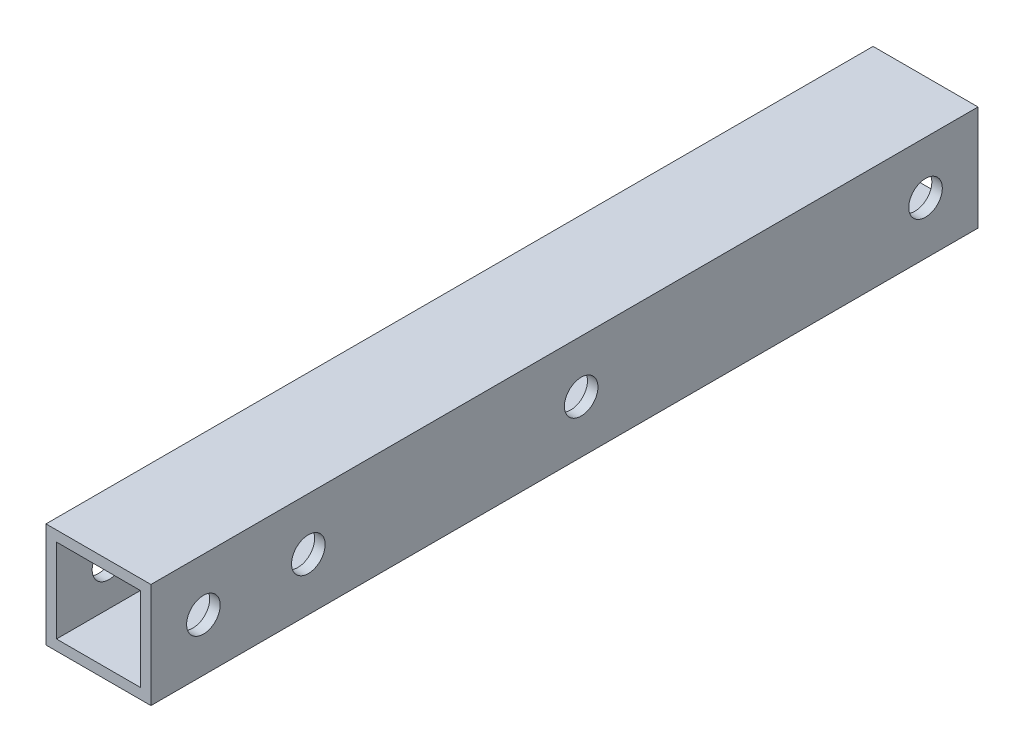
from build123d import *

# Parameters (mm, degrees)
SKETCH_1_W          = 10
SKETCH_1_H          = 10
SKETCH_1_W_2        = 8
SKETCH_1_H_2        = 8
EXTRUDE_1_DEPTH     = 78.81860214
SKETCH_2_R          = 1.6
CUT_EXTRUDE_1_DEPTH = 80.607612973
SKETCH_3_R          = 1.6
CUT_EXTRUDE_3_DEPTH = 80.607612973


with BuildPart() as part:
    # ｽｹｯﾁ1 → ﾎﾞｽ - 押し出し1 (new body)
    with BuildSketch(Plane.XY):
        Rectangle(SKETCH_1_W, SKETCH_1_H)
        Rectangle(SKETCH_1_W_2, SKETCH_1_H_2, mode=Mode.SUBTRACT)
    extrude(amount=EXTRUDE_1_DEPTH)

    # ｽｹｯﾁ2 → ｶｯﾄ - 押し出し1 (cut, through all)
    with BuildSketch(Plane(origin=(5, 0, 0), x_dir=(0, 0, -1), z_dir=(1, 0, 0))):
        with Locations((-5, 0)):
            Circle(SKETCH_2_R)
        with Locations((-73.81860214, 0)):
            Circle(SKETCH_2_R)
    extrude(amount=-CUT_EXTRUDE_1_DEPTH, mode=Mode.SUBTRACT)

    # ｽｹｯﾁ3 → ｶｯﾄ - 押し出し3 (cut, through all)
    with BuildSketch(Plane.ZY.offset(5)):
        with Locations((63.81860214, 0)):
            Circle(SKETCH_3_R)
        with Locations((37.81860214, 0)):
            Circle(SKETCH_3_R)
    extrude(amount=-CUT_EXTRUDE_3_DEPTH, mode=Mode.SUBTRACT)


solid = part.part
